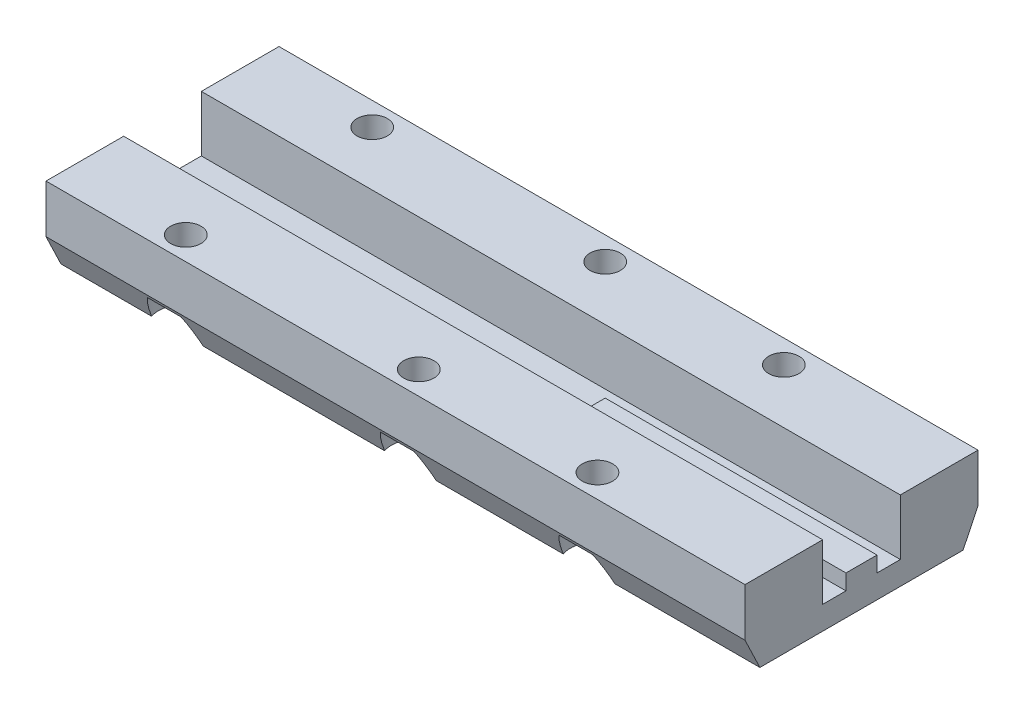
from build123d import *

# Parameters (mm, degrees)
EXTRUDE_1_DEPTH     = 90
EXTRUDE_1_2_DEPTH   = 90
SKETCH_3_R          = 1.95
CUT_EXTRUDE_1_DEPTH = 92.809803398
SKETCH_5_W          = 35
SKETCH_5_H          = 5
EXTRUDE_2_DEPTH     = 2
SKETCH_7_R          = 3.5
CUT_EXTRUDE_2_DEPTH = 3.5


with BuildPart() as part:
    # 스케치1 → 보스-돌출1 (new body)
    with BuildSketch(Plane(origin=(0, 0, 0), x_dir=(0, 0, -1), z_dir=(1, 0, 0))):
        Polygon((-15, 0), (-15, -6.2), (-13.081136552, -10.2), (-1.95, -10.2), (-1.95, -7.2), (-5, -7.2), (-5, 0), align=None)
    extrude(amount=EXTRUDE_1_DEPTH)


with BuildPart() as body_2:
    # 스케치1 → Extrude 1 2 (new body)
    with BuildSketch(Plane(origin=(0, 0, 0), x_dir=(0, 0, -1), z_dir=(1, 0, 0))):
        Polygon((13.081136552, -10.2), (15, -6.2), (15, 0), (5, 0), (5, -7.2), (1.95, -7.2), (1.95, -10.2), align=None)
    extrude(amount=EXTRUDE_1_2_DEPTH)


with BuildPart() as cut_extrude_1_tool:
    # 스케치3 → 컷-돌출1 (new, through all)
    with BuildSketch(Plane.XZ.offset(10.2)):
        with Locations(Location((15, 12, 0), (0, 0, 270))):
            Circle(SKETCH_3_R)
        with Locations(Location((45, 12, 0), (0, 0, 270))):
            Circle(SKETCH_3_R)
        with Locations(Location((68, 12, 0), (0, 0, 270))):
            Circle(SKETCH_3_R)
        with Locations(Location((68, -12, 0), (0, 0, 270))):
            Circle(SKETCH_3_R)
        with Locations(Location((45, -12, 0), (0, 0, 270))):
            Circle(SKETCH_3_R)
        with Locations(Location((15, -12, 0), (0, 0, 270))):
            Circle(SKETCH_3_R)
    extrude(amount=-CUT_EXTRUDE_1_DEPTH)


with BuildPart() as part_1:
    add(part.part)

    # 컷-돌출1: cut by cut_extrude_1_tool
    add(cut_extrude_1_tool.part, mode=Mode.SUBTRACT)



with BuildPart() as body_2_1:
    add(body_2.part)

    # 컷-돌출1: cut by cut_extrude_1_tool
    add(cut_extrude_1_tool.part, mode=Mode.SUBTRACT)


with BuildPart() as part_2:
    add(part_1.part)

    add(body_2_1.part)  # 보스-돌출2 merges body 2
    # 스케치5 → 보스-돌출2 (add, symmetric)
    with BuildSketch(Plane.XY):
        with Locations((72.5, -7.7)):
            Rectangle(SKETCH_5_W, SKETCH_5_H)
    extrude(amount=EXTRUDE_2_DEPTH, both=True)

    # 스케치7 → 컷-돌출2 (cut)
    with BuildSketch(Plane.XZ.offset(10.2)):
        with Locations((15, -12)):
            Circle(SKETCH_7_R)
        with Locations((45, -12)):
            Circle(SKETCH_7_R)
        with Locations((68, -12)):
            Circle(SKETCH_7_R)
        with Locations((45, 12)):
            Circle(SKETCH_7_R)
        with Locations((68, 12)):
            Circle(SKETCH_7_R)
        with Locations((15, 12)):
            Circle(SKETCH_7_R)
    extrude(amount=-CUT_EXTRUDE_2_DEPTH, mode=Mode.SUBTRACT)


solid = part_2.part
